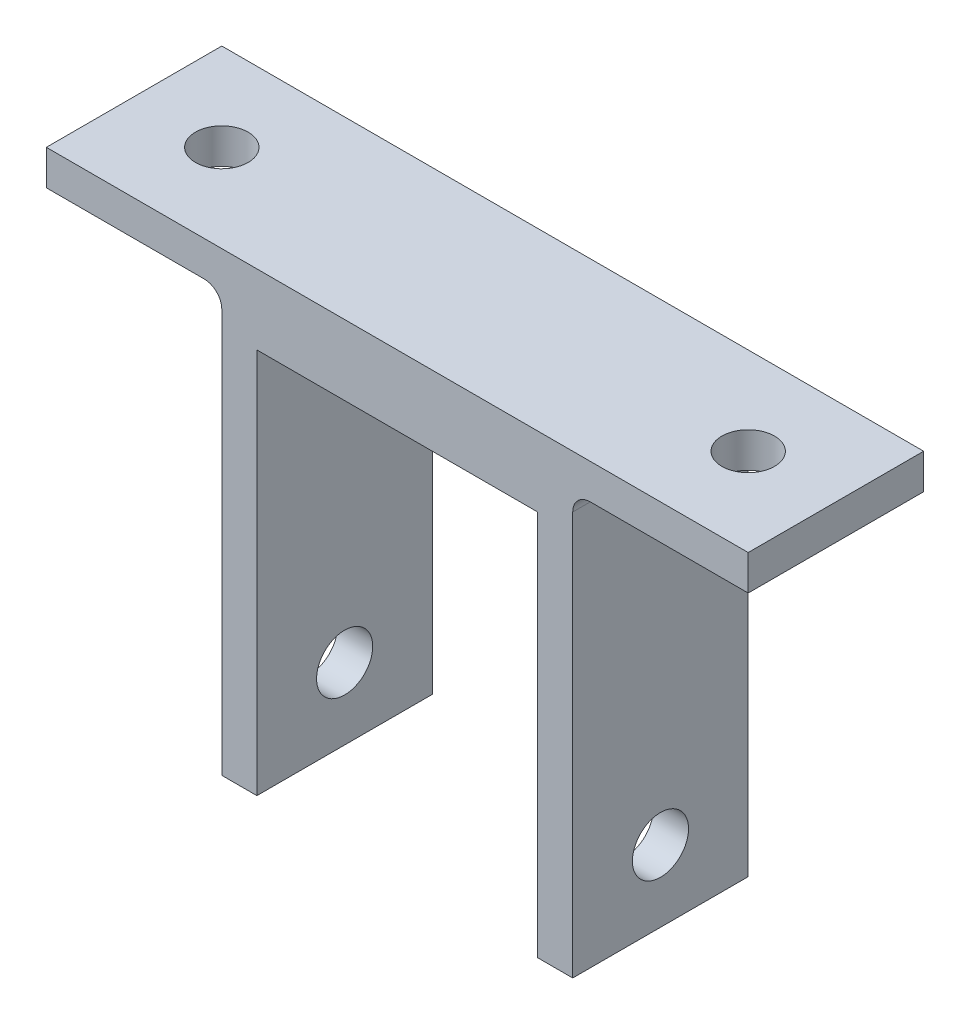
from build123d import *

# Parameters (mm, degrees)
BOSS_EXTRUDE1_DEPTH = 10
SKETCH2_W           = 40
SKETCH2_H           = 10
SKETCH2_R           = 1.5
BOSS_EXTRUDE2_DEPTH = 2
FILLET1_R           = 1
SKETCH3_R           = 1.6
CUT_EXTRUDE1_DEPTH  = 35.583232932


with BuildPart() as part:
    # Sketch1 → Boss-Extrude1 (new body)
    with BuildSketch(Plane.XY):
        Polygon((-10, 10), (-10, -10), (-10, -14), (-8, -14), (-8, -8), (-8, 8), (8, 8), (8, -8), (8, -14), (10, -14), (10, -10), (10, 10), align=None)
    extrude(amount=BOSS_EXTRUDE1_DEPTH)

    # Sketch2 → Boss-Extrude2 (add)
    with BuildSketch(Plane(origin=(0, 10, 0), x_dir=(1, 0, 0), z_dir=(0, 1, 0))):
        with Locations((0, -5)):
            Rectangle(SKETCH2_W, SKETCH2_H)
        with Locations(Location((-15, -5, 0), (0, 0, 270))):
            Circle(SKETCH2_R, mode=Mode.SUBTRACT)
        with Locations(Location((15, -5, 0), (0, 0, 90))):
            Circle(SKETCH2_R, mode=Mode.SUBTRACT)
    extrude(amount=BOSS_EXTRUDE2_DEPTH)

    # Fillet1
    fillet1_edges = [part.edges().sort_by_distance(p)[0] for p in [
        (-10, 10, 5),
        (10, 10, 5),
    ]]
    fillet(fillet1_edges, radius=FILLET1_R)

    # Sketch3 → Cut-Extrude1 (cut, through all)
    with BuildSketch(Plane(origin=(10, 0, 0), x_dir=(0, 0, -1), z_dir=(1, 0, 0))):
        with Locations((-5, -9.930512369)):
            Circle(SKETCH3_R)
    extrude(amount=-CUT_EXTRUDE1_DEPTH, mode=Mode.SUBTRACT)


solid = part.part
